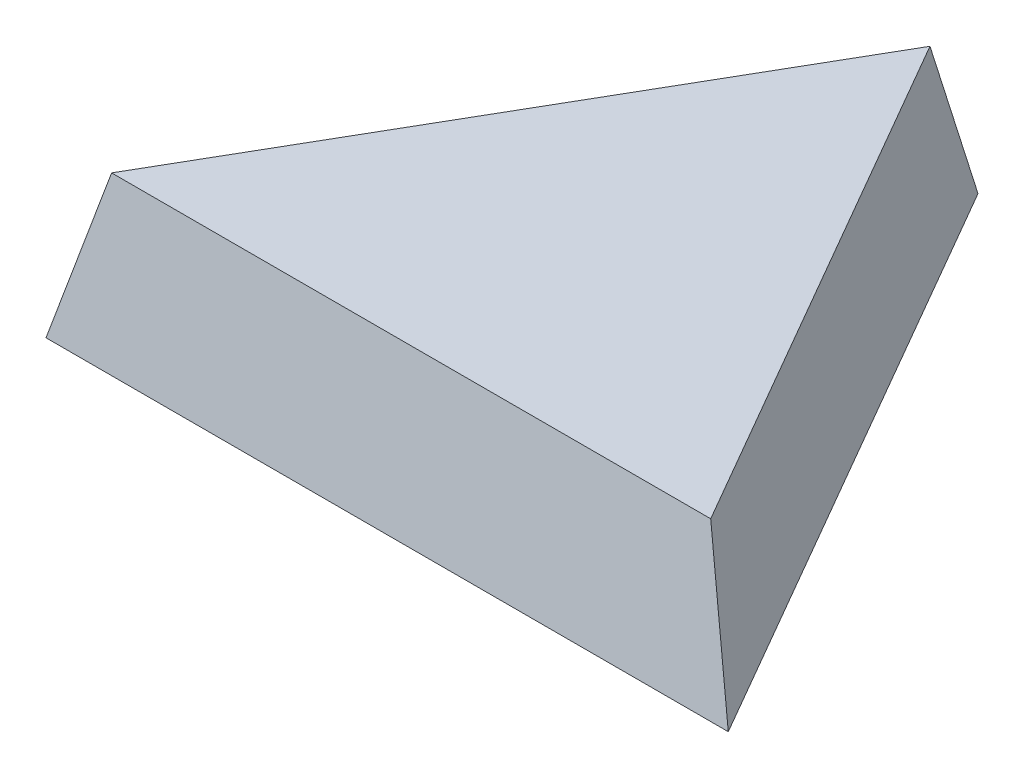
from build123d import *

# Parameters (mm, degrees)
BOSS_EXTRUDE1_DEPTH = 2
BOSS_EXTRUDE1_TAPER = 9


with BuildPart() as part:
    # Sketch1 → Boss-Extrude1 (new body)
    with BuildSketch(Plane(origin=(0, 0, 0), x_dir=(1, 0, 0), z_dir=(0, 1, 0))):
        Polygon((3.433738771, -0.855856628), (-1.066261229, 6.938372006), (-5.566261229, -0.855856628), align=None)
    extrude(amount=BOSS_EXTRUDE1_DEPTH, taper=BOSS_EXTRUDE1_TAPER)


solid = part.part
